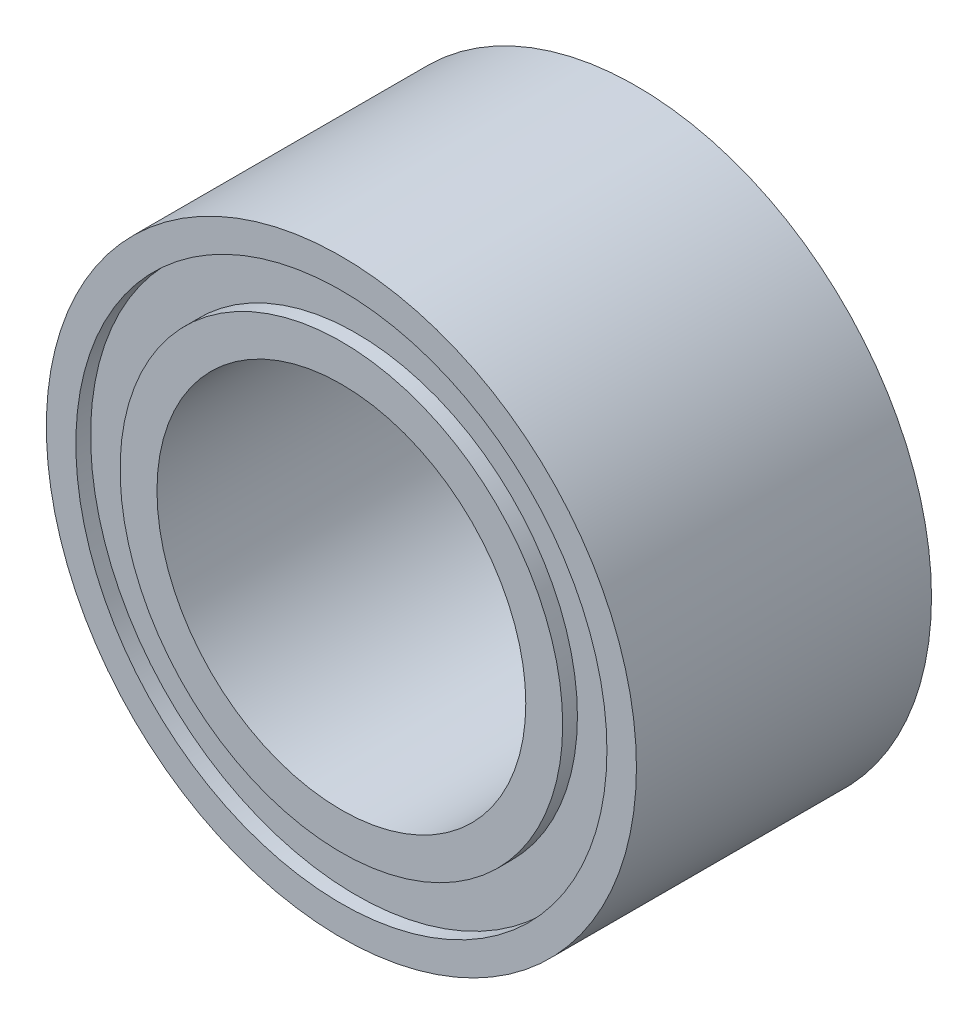
from build123d import *

# Parameters (mm, degrees)
SKETCH1_R           = 5.08
SKETCH1_R_2         = 3.175
BOSS_EXTRUDE1_DEPTH = 5.08
SKETCH2_R           = 4.572
SKETCH2_R_2         = 3.81
CUT_EXTRUDE1_DEPTH  = 0.254


with BuildPart() as part:
    # Sketch1 → Boss-Extrude1 (new body)
    with BuildSketch(Plane.XY):
        Circle(SKETCH1_R)
        Circle(SKETCH1_R_2, mode=Mode.SUBTRACT)
    extrude(amount=BOSS_EXTRUDE1_DEPTH)

    # Sketch2 → Cut-Extrude1 (cut)
    with BuildSketch(Plane.XY.offset(5.08)):
        Circle(SKETCH2_R)
        Circle(SKETCH2_R_2, mode=Mode.SUBTRACT)
    cut_extrude1 = extrude(amount=-CUT_EXTRUDE1_DEPTH, mode=Mode.SUBTRACT)

    # Mirror1: Cut-Extrude1 across plane
    add(cut_extrude1.mirror(Plane.XY.offset(2.54)), mode=Mode.SUBTRACT)


solid = part.part
